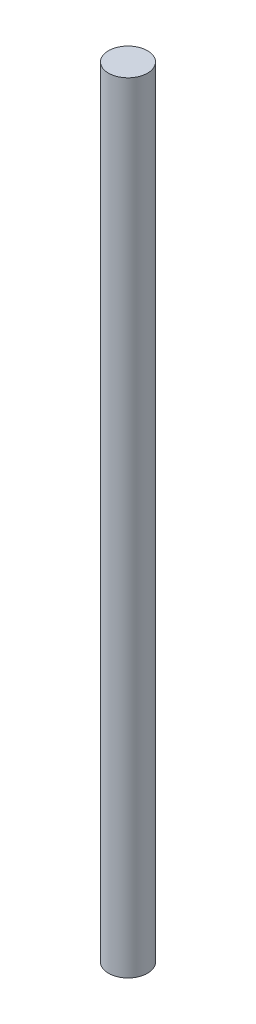
from build123d import *

# Parameters (mm, degrees)
SKETCH1_R           = 3.5
BOSS_EXTRUDE1_DEPTH = 140


with BuildPart() as part:
    # Sketch1 → Boss-Extrude1 (new body)
    with BuildSketch(Plane(origin=(0, 0, 0), x_dir=(1, 0, 0), z_dir=(0, 1, 0))):
        with Locations(Location((0, 0, 0), (0, 0, 270))):
            Circle(SKETCH1_R)
    extrude(amount=BOSS_EXTRUDE1_DEPTH)


solid = part.part
